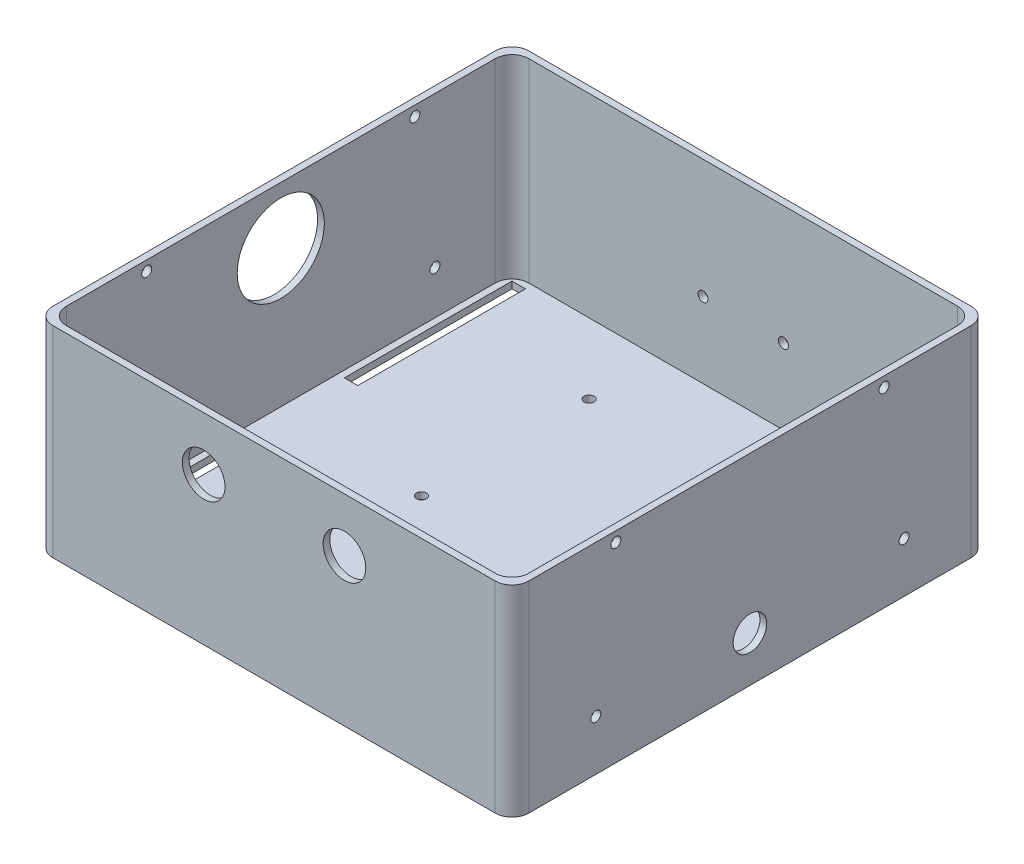
from build123d import *

# Parameters (mm, degrees)
SKETCH1_W           = 142
SKETCH1_H           = 142
BOSS_EXTRUDE1_DEPTH = 60
SKETCH3_W           = 138
SKETCH3_H           = 138
CUT_EXTRUDE1_DEPTH  = 58
SKETCH12_W          = 4
SKETCH12_H          = 50
CUT_EXTRUDE8_DEPTH  = 116.956888541
SKETCH13_R          = 1.5
CUT_EXTRUDE9_DEPTH  = 116.956888541
CUT_EXTRUDE6_REACH  = 171.72
SKETCH9_R           = 5
SKETCH14_R          = 6.363961031
CUT_EXTRUDE10_DEPTH = 169.050587622
CUT_EXTRUDE11_REACH = 171.72
SKETCH16_R          = 13
SKETCH18_R          = 1.5
CUT_EXTRUDE12_DEPTH = 170.720358237
FILLET1_R           = 5
SKETCH19_R          = 1.5
CUT_EXTRUDE13_DEPTH = 170.720358237
SKETCH21_R          = 1.5
CUT_EXTRUDE14_DEPTH = 15


with BuildPart() as part:
    # Sketch1 → Boss-Extrude1 (new body)
    with BuildSketch(Plane(origin=(0, 0, 0), x_dir=(1, 0, 0), z_dir=(0, 1, 0))):
        Rectangle(SKETCH1_W, SKETCH1_H)
    extrude(amount=BOSS_EXTRUDE1_DEPTH)

    # Sketch3 → Cut-Extrude1 (cut)
    with BuildSketch(Plane(origin=(0, 60, 0), x_dir=(1, 0, 0), z_dir=(0, 1, 0))):
        Rectangle(SKETCH3_W, SKETCH3_H)
    extrude(amount=-CUT_EXTRUDE1_DEPTH, mode=Mode.SUBTRACT)

    # Sketch12 → Cut-Extrude8 (cut, through all)
    with BuildSketch(Plane(origin=(0, 2, 0), x_dir=(1, 0, 0), z_dir=(0, 1, 0))):
        with Locations((-65, -42)):
            Rectangle(SKETCH12_W, SKETCH12_H)
        with Locations((-65, 42)):
            Rectangle(SKETCH12_W, SKETCH12_H)
    cut_extrude8 = extrude(amount=-CUT_EXTRUDE8_DEPTH, mode=Mode.SUBTRACT)

    # Mirror2: Cut-Extrude8 across plane
    add(cut_extrude8.mirror(Plane(origin=(0, 0, 0), x_dir=(0, 0, 1), z_dir=(1, 0, 0))), mode=Mode.SUBTRACT)

    # Sketch13 → Cut-Extrude9 (cut, through all)
    with BuildSketch(Plane(origin=(0, 2, 0), x_dir=(1, 0, 0), z_dir=(0, 1, 0))):
        with Locations(Location((-25, -2, 0), (0, 0, 270))):
            Circle(SKETCH13_R)
        with Locations(Location((25, -2, 0), (0, 0, 270))):
            Circle(SKETCH13_R)
        with Locations(Location((25, -52, 0), (0, 0, 270))):
            Circle(SKETCH13_R)
        with Locations(Location((-25, -52, 0), (0, 0, 270))):
            Circle(SKETCH13_R)
        with Locations(Location((-25, 48, 0), (0, 0, 270))):
            Circle(SKETCH13_R)
        with Locations(Location((25, 48, 0), (0, 0, 270))):
            Circle(SKETCH13_R)
    extrude(amount=-CUT_EXTRUDE9_DEPTH, mode=Mode.SUBTRACT)

    # Sketch9 → Cut-Extrude6 (cut, up to next)
    with BuildSketch(Plane(origin=(71, 0, 0), x_dir=(0, 0, -1), z_dir=(1, 0, 0)), mode=Mode.PRIVATE) as cut_extrude6_sk1:
        with Locations((0, 13.5)):
            Circle(SKETCH9_R)
    cut_extrude6_tool1 = extrude(cut_extrude6_sk1.sketch, amount=-CUT_EXTRUDE6_REACH, mode=Mode.PRIVATE) & part.part
    add(cut_extrude6_tool1.solids().sort_by_distance((71, 13.5, 0))[0], mode=Mode.SUBTRACT)

    # Sketch14 → Cut-Extrude10 (cut, through all)
    with BuildSketch(Plane(origin=(0, 0, 69), x_dir=(-1, 0, 0), z_dir=(0, 0, -1))):
        with Locations((21, 44)):
            Circle(SKETCH14_R)
    cut_extrude10 = extrude(amount=-CUT_EXTRUDE10_DEPTH, mode=Mode.SUBTRACT)

    # Mirror3: Cut-Extrude10 across plane
    add(cut_extrude10.mirror(Plane(origin=(0, 0, 0), x_dir=(0, 0, 1), z_dir=(1, 0, 0))), mode=Mode.SUBTRACT)

    # Sketch16 → Cut-Extrude11 (cut, up to next)
    with BuildSketch(Plane.ZY.offset(71), mode=Mode.PRIVATE) as cut_extrude11_sk1:
        with Locations((0, 43)):
            Circle(SKETCH16_R)
    cut_extrude11_tool1 = extrude(cut_extrude11_sk1.sketch, amount=-CUT_EXTRUDE11_REACH, mode=Mode.PRIVATE) & part.part
    add(cut_extrude11_tool1.solids().sort_by_distance((-71, 43, 0))[0], mode=Mode.SUBTRACT)

    # Sketch18 → Cut-Extrude12 (cut, through all)
    with BuildSketch(Plane.ZY.offset(71)):
        with Locations((-46, 15)):
            Circle(SKETCH18_R)
        with Locations((46, 15)):
            Circle(SKETCH18_R)
    extrude(amount=-CUT_EXTRUDE12_DEPTH, mode=Mode.SUBTRACT)

    # Fillet1
    fillet1_edges = [part.edges().sort_by_distance(p)[0] for p in [
        (-69, 31, 69),
        (-69, 31, -69),
        (69, 31, -69),
        (69, 31, 69),
        (71, 30, 71),
        (-71, 30, 71),
        (-71, 30, -71),
        (71, 30, -71),
    ]]
    fillet(fillet1_edges, radius=FILLET1_R)

    # Sketch19 → Cut-Extrude13 (cut, through all)
    with BuildSketch(Plane.ZY.offset(71)):
        with Locations((-40, 57)):
            Circle(SKETCH19_R)
        with Locations((40, 57)):
            Circle(SKETCH19_R)
    extrude(amount=-CUT_EXTRUDE13_DEPTH, mode=Mode.SUBTRACT)

    # Sketch21 → Cut-Extrude14 (cut)
    with BuildSketch(Plane.XY.offset(-71)):
        with Locations(Location((-12, 24.5, 0), (0, 0, 180))):
            Circle(SKETCH21_R)
        with Locations(Location((12, 24.5, 0), (0, 0, 180))):
            Circle(SKETCH21_R)
    extrude(amount=CUT_EXTRUDE14_DEPTH, mode=Mode.SUBTRACT)


solid = part.part
